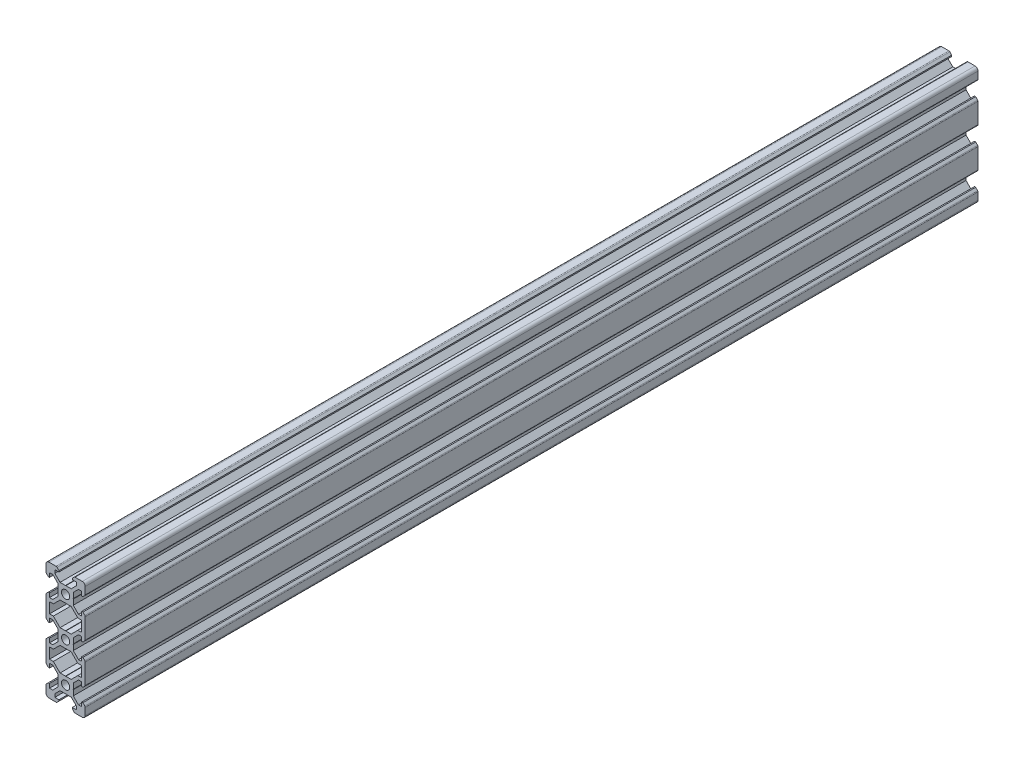
from build123d import *

# Parameters (mm, degrees)
SKETCH1_R           = 2.1
BOSS_EXTRUDE2_DEPTH = 455


with BuildPart() as part:
    # Sketch1 → Boss-Extrude2 (new body)
    with BuildSketch(Plane.XY):
        with BuildLine():
            Line((-8.5, 10), (-4.862792737, 10))
            ThreePointArc((-4.862792737, 10), (-4.598292737, 9.947387679), (-4.374060464, 9.797560464))
            Line((-4.374060464, 9.797560464), (-3.3865, 8.81))
            Line((-3.3865, 8.81), (-3.3865, 8.2))
            Line((-3.3865, 8.2), (-5.5, 8.2))
            Line((-5.5, 8.2), (-5.5, 6.561))
            Line((-5.5, 6.561), (-2.8395, 3.9005))
            Line((-2.8395, 3.9005), (-0.1, 3.9005))
            Line((-0.1, 3.9005), (0, 3.8005))
            Line((0, 3.8005), (0.1, 3.9005))
            Line((0.1, 3.9005), (2.8395, 3.9005))
            Line((2.8395, 3.9005), (5.5, 6.561))
            Line((5.5, 6.561), (5.5, 8.2))
            Line((5.5, 8.2), (3.3865, 8.2))
            Line((3.3865, 8.2), (3.3865, 8.81))
            Line((3.3865, 8.81), (4.374060464, 9.797560464))
            ThreePointArc((4.374060464, 9.797560464), (4.598292737, 9.947387679), (4.862792737, 10))
            Line((4.862792737, 10), (8.5, 10))
            ThreePointArc((8.5, 10), (9.560660172, 9.560660172), (10, 8.5))
            Line((10, 8.5), (10, 4.862792737))
            ThreePointArc((10, 4.862792737), (9.947387679, 4.598292737), (9.797560464, 4.374060464))
            Line((9.797560464, 4.374060464), (8.81, 3.3865))
            Line((8.81, 3.3865), (8.2, 3.3865))
            Line((8.2, 3.3865), (8.2, 5.5))
            Line((8.2, 5.5), (6.561, 5.5))
            Line((6.561, 5.5), (3.9005, 2.8395))
            Line((3.9005, 2.8395), (3.9005, 0.1))
            Line((3.9005, 0.1), (3.8005, 0))
            Line((3.8005, 0), (3.9005, -0.1))
            Line((3.9005, -0.1), (3.9005, -2.8395))
            Line((3.9005, -2.8395), (6.561, -5.5))
            Line((6.561, -5.5), (8.2, -5.5))
            Line((8.2, -5.5), (8.2, -3.3865))
            Line((8.2, -3.3865), (8.81, -3.3865))
            Line((8.81, -3.3865), (9.797560464, -4.374060464))
            ThreePointArc((9.797560464, -4.374060464), (9.947387679, -4.598292737), (10, -4.862792737))
            Line((10, -4.862792737), (10, -15.137207263))
            ThreePointArc((10, -15.137207263), (9.947387679, -15.401707263), (9.797560464, -15.625939536))
            Line((9.797560464, -15.625939536), (8.81, -16.6135))
            Line((8.81, -16.6135), (8.2, -16.6135))
            Line((8.2, -16.6135), (8.2, -14.5))
            Line((8.2, -14.5), (6.561, -14.5))
            Line((6.561, -14.5), (3.9005, -17.1605))
            Line((3.9005, -17.1605), (3.9005, -19.9))
            Line((3.9005, -19.9), (3.8005, -20))
            Line((3.8005, -20), (3.9005, -20.1))
            Line((3.9005, -20.1), (3.9005, -22.8395))
            Line((3.9005, -22.8395), (6.561, -25.5))
            Line((6.561, -25.5), (8.2, -25.5))
            Line((8.2, -25.5), (8.2, -23.3865))
            Line((8.2, -23.3865), (8.81, -23.3865))
            Line((8.81, -23.3865), (9.797560464, -24.374060464))
            ThreePointArc((9.797560464, -24.374060464), (9.947387679, -24.598292737), (10, -24.862792737))
            Line((10, -24.862792737), (10, -35.137207263))
            ThreePointArc((10, -35.137207263), (9.947387679, -35.401707263), (9.797560464, -35.625939536))
            Line((9.797560464, -35.625939536), (8.81, -36.6135))
            Line((8.81, -36.6135), (8.2, -36.6135))
            Line((8.2, -36.6135), (8.2, -34.5))
            Line((8.2, -34.5), (6.561, -34.5))
            Line((6.561, -34.5), (3.9005, -37.1605))
            Line((3.9005, -37.1605), (3.9005, -39.9))
            Line((3.9005, -39.9), (3.8005, -40))
            Line((3.8005, -40), (3.9005, -40.1))
            Line((3.9005, -40.1), (3.9005, -42.8395))
            Line((3.9005, -42.8395), (6.561, -45.5))
            Line((6.561, -45.5), (8.2, -45.5))
            Line((8.2, -45.5), (8.2, -43.3865))
            Line((8.2, -43.3865), (8.81, -43.3865))
            Line((8.81, -43.3865), (9.797560464, -44.374060464))
            ThreePointArc((9.797560464, -44.374060464), (9.947387679, -44.598292737), (10, -44.862792737))
            Line((10, -44.862792737), (10, -48.5))
            ThreePointArc((10, -48.5), (9.560660172, -49.560660172), (8.5, -50))
            Line((8.5, -50), (4.862792737, -50))
            ThreePointArc((4.862792737, -50), (4.598292737, -49.947387679), (4.374060464, -49.797560464))
            Line((4.374060464, -49.797560464), (3.3865, -48.81))
            Line((3.3865, -48.81), (3.3865, -48.2))
            Line((3.3865, -48.2), (5.5, -48.2))
            Line((5.5, -48.2), (5.5, -46.561))
            Line((5.5, -46.561), (2.8395, -43.9005))
            Line((2.8395, -43.9005), (0.1, -43.9005))
            Line((0.1, -43.9005), (0, -43.8005))
            Line((0, -43.8005), (-0.1, -43.9005))
            Line((-0.1, -43.9005), (-2.8395, -43.9005))
            Line((-2.8395, -43.9005), (-5.5, -46.561))
            Line((-5.5, -46.561), (-5.5, -48.2))
            Line((-5.5, -48.2), (-3.3865, -48.2))
            Line((-3.3865, -48.2), (-3.3865, -48.81))
            Line((-3.3865, -48.81), (-4.374060464, -49.797560464))
            ThreePointArc((-4.374060464, -49.797560464), (-4.598292737, -49.947387679), (-4.862792737, -50))
            Line((-4.862792737, -50), (-8.5, -50))
            ThreePointArc((-8.5, -50), (-9.560660172, -49.560660172), (-10, -48.5))
            Line((-10, -48.5), (-10, -44.862792737))
            ThreePointArc((-10, -44.862792737), (-9.947387679, -44.598292737), (-9.797560464, -44.374060464))
            Line((-9.797560464, -44.374060464), (-8.81, -43.3865))
            Line((-8.81, -43.3865), (-8.2, -43.3865))
            Line((-8.2, -43.3865), (-8.2, -45.5))
            Line((-8.2, -45.5), (-6.561, -45.5))
            Line((-6.561, -45.5), (-3.9005, -42.8395))
            Line((-3.9005, -42.8395), (-3.9005, -40.1))
            Line((-3.9005, -40.1), (-3.8005, -40))
            Line((-3.8005, -40), (-3.9005, -39.9))
            Line((-3.9005, -39.9), (-3.9005, -37.1605))
            Line((-3.9005, -37.1605), (-6.561, -34.5))
            Line((-6.561, -34.5), (-8.2, -34.5))
            Line((-8.2, -34.5), (-8.2, -36.6135))
            Line((-8.2, -36.6135), (-8.81, -36.6135))
            Line((-8.81, -36.6135), (-9.797560464, -35.625939536))
            ThreePointArc((-9.797560464, -35.625939536), (-9.947387679, -35.401707263), (-10, -35.137207263))
            Line((-10, -35.137207263), (-10, -24.862792737))
            ThreePointArc((-10, -24.862792737), (-9.947387679, -24.598292737), (-9.797560464, -24.374060464))
            Line((-9.797560464, -24.374060464), (-8.81, -23.3865))
            Line((-8.81, -23.3865), (-8.2, -23.3865))
            Line((-8.2, -23.3865), (-8.2, -25.5))
            Line((-8.2, -25.5), (-6.561, -25.5))
            Line((-6.561, -25.5), (-3.9005, -22.8395))
            Line((-3.9005, -22.8395), (-3.9005, -20.1))
            Line((-3.9005, -20.1), (-3.8005, -20))
            Line((-3.8005, -20), (-3.9005, -19.9))
            Line((-3.9005, -19.9), (-3.9005, -17.1605))
            Line((-3.9005, -17.1605), (-6.561, -14.5))
            Line((-6.561, -14.5), (-8.2, -14.5))
            Line((-8.2, -14.5), (-8.2, -16.6135))
            Line((-8.2, -16.6135), (-8.81, -16.6135))
            Line((-8.81, -16.6135), (-9.797560464, -15.625939536))
            ThreePointArc((-9.797560464, -15.625939536), (-9.947387679, -15.401707263), (-10, -15.137207263))
            Line((-10, -15.137207263), (-10, -4.862792737))
            ThreePointArc((-10, -4.862792737), (-9.947387679, -4.598292737), (-9.797560464, -4.374060464))
            Line((-9.797560464, -4.374060464), (-8.81, -3.3865))
            Line((-8.81, -3.3865), (-8.2, -3.3865))
            Line((-8.2, -3.3865), (-8.2, -5.5))
            Line((-8.2, -5.5), (-6.561, -5.5))
            Line((-6.561, -5.5), (-3.9005, -2.8395))
            Line((-3.9005, -2.8395), (-3.9005, -0.1))
            Line((-3.9005, -0.1), (-3.8005, 0))
            Line((-3.8005, 0), (-3.9005, 0.1))
            Line((-3.9005, 0.1), (-3.9005, 2.8395))
            Line((-3.9005, 2.8395), (-6.561, 5.5))
            Line((-6.561, 5.5), (-8.2, 5.5))
            Line((-8.2, 5.5), (-8.2, 3.3865))
            Line((-8.2, 3.3865), (-8.81, 3.3865))
            Line((-8.81, 3.3865), (-9.797560464, 4.374060464))
            ThreePointArc((-9.797560464, 4.374060464), (-9.947387679, 4.598292737), (-10, 4.862792737))
            Line((-10, 4.862792737), (-10, 8.5))
            ThreePointArc((-10, 8.5), (-9.560660172, 9.560660172), (-8.5, 10))
        make_face()
        with Locations(Location((0, 0, 0), (0, 0, 180))):
            Circle(SKETCH1_R, mode=Mode.SUBTRACT)
        with Locations(Location((0, -20, 0), (0, 0, 180))):
            Circle(SKETCH1_R, mode=Mode.SUBTRACT)
        with Locations(Location((0, -40, 0), (0, 0, 180))):
            Circle(SKETCH1_R, mode=Mode.SUBTRACT)
        Polygon((-8.2, -12.7), (-8.2, -7.3), (-6.239, -7.3), (-5.5, -6.561), (-2.8395, -3.9005), (-0.1, -3.9005), (0, -3.8005), (0.1, -3.9005), (2.8395, -3.9005), (5.5, -6.561), (6.239, -7.3), (8.2, -7.3), (8.2, -12.7), (6.239, -12.7), (5.5, -13.439), (2.8395, -16.0995), (0.1, -16.0995), (0, -16.1995), (-0.1, -16.0995), (-2.8395, -16.0995), (-5.5, -13.439), (-6.239, -12.7), align=None, mode=Mode.SUBTRACT)
        Polygon((2.8395, -23.9005), (5.5, -26.561), (6.239, -27.3), (8.2, -27.3), (8.2, -32.7), (6.239, -32.7), (5.5, -33.439), (2.8395, -36.0995), (0.1, -36.0995), (0, -36.1995), (-0.1, -36.0995), (-2.8395, -36.0995), (-5.5, -33.439), (-6.239, -32.7), (-8.2, -32.7), (-8.2, -27.3), (-6.239, -27.3), (-5.5, -26.561), (-2.8395, -23.9005), (-0.1, -23.9005), (0, -23.8005), (0.1, -23.9005), align=None, mode=Mode.SUBTRACT)
    extrude(amount=BOSS_EXTRUDE2_DEPTH)


solid = part.part
